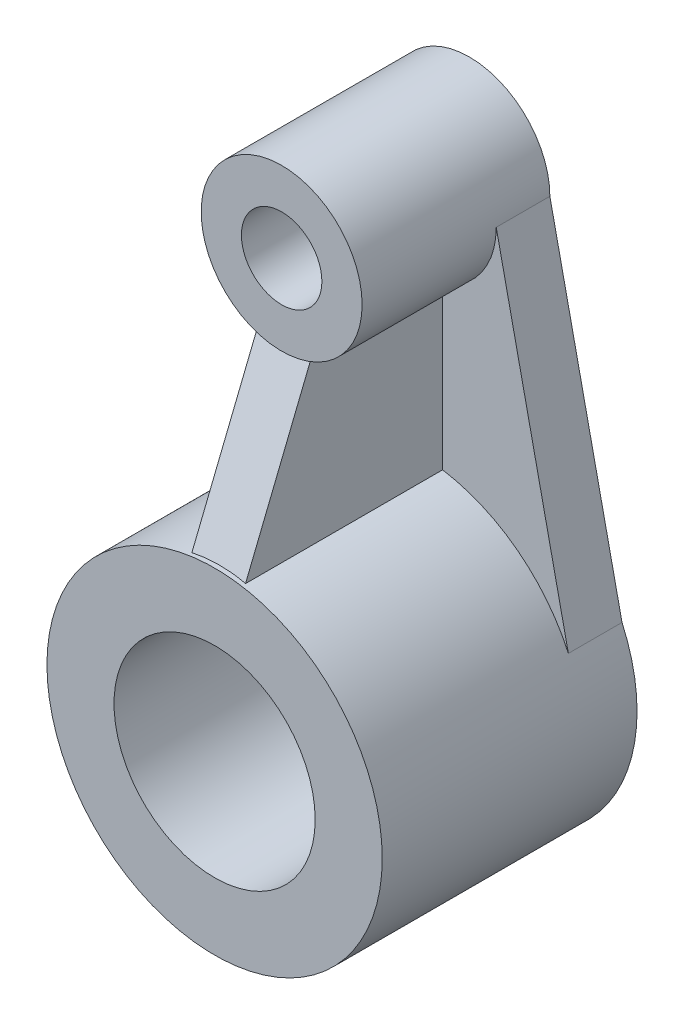
from build123d import *
from build123d.topology import SkipClean

# Parameters (mm, degrees)
SKETCH2_R           = 25
SKETCH2_R_2         = 15
BOSS_EXTRUDE1_DEPTH = 38
BOSS_EXTRUDE3_START = -8
BOSS_EXTRUDE3_DEPTH = 8
SKETCH4_R           = 12
SKETCH4_R_2         = 6
BOSS_EXTRUDE4_DEPTH = 20
BOSS_EXTRUDE5_START = 8
BOSS_EXTRUDE5_DEPTH = 8
CUT_EXTRUDE1_START  = -71
CUT_EXTRUDE1_DEPTH  = 71
BOSS_EXTRUDE8_DEPTH = 4


with BuildPart() as part:
    # Sketch2 → Boss-Extrude1 (new body)
    with BuildSketch(Plane.XY):
        with Locations((0, 6.726092211)):
            Circle(SKETCH2_R)
        with Locations((0, 6.726092211)):
            Circle(SKETCH2_R_2, mode=Mode.SUBTRACT)
    extrude(amount=-BOSS_EXTRUDE1_DEPTH)

    # Sketch5 → Boss-Extrude3 (add)
    with BuildSketch(Plane(origin=(0, 0, -38), x_dir=(-1, 0, 0), z_dir=(0, 0, -1)).offset(BOSS_EXTRUDE3_START)):
        with BuildLine():
            Line((-12, 66.726092211), (-22.758026002, 17.073664512))
            ThreePointArc((-22.758026002, 17.073664512), (0, 31.726092211), (22.758026002, 17.073664512))
            Line((22.758026002, 17.073664512), (12, 66.726092211))
            Line((12, 66.726092211), (-12, 66.726092211))
        make_face()
    extrude(amount=BOSS_EXTRUDE3_DEPTH)

    # Sketch4 → Boss-Extrude4 (add)
    with BuildSketch(Plane.XY.offset(-30)):
        with Locations((0, 66.726092211)):
            Circle(SKETCH4_R)
        with Locations((0, 66.726092211)):
            Circle(SKETCH4_R_2, mode=Mode.SUBTRACT)
    extrude(amount=BOSS_EXTRUDE4_DEPTH)

    # Sketch6 → Boss-Extrude5 (add)
    with BuildSketch(Plane(origin=(0, 0, -30), x_dir=(-1, 0, 0), z_dir=(0, 0, -1)).offset(BOSS_EXTRUDE5_START)):
        with BuildLine():
            Line((6, 66.726092211), (12, 66.726092211))
            ThreePointArc((12, 66.726092211), (0, 78.726092211), (-12, 66.726092211))
            Line((-12, 66.726092211), (-6, 66.726092211))
            ThreePointArc((-6, 66.726092211), (0, 72.726092211), (6, 66.726092211))
        make_face()
    extrude(amount=-BOSS_EXTRUDE5_DEPTH)

    # Sketch8 → Cut-Extrude1 (cut)
    with SkipClean():  # the faces are left unmerged after this step: merging them gives an invalid solid
        with BuildSketch(Plane.XY.offset(-30).offset(CUT_EXTRUDE1_START)):
            with BuildLine():
                Line((-6, 66.726092211), (6, 66.726092211))
                ThreePointArc((6, 66.726092211), (0, 60.726092211), (-6, 66.726092211))
            make_face()
        extrude(amount=CUT_EXTRUDE1_DEPTH, mode=Mode.SUBTRACT)

    # Sketch9 → Boss-Extrude8 (add, symmetric)
    with SkipClean():  # the faces are left unmerged after this step: merging them gives an invalid solid
        with BuildSketch(Plane(origin=(0, 0, 0), x_dir=(0, 0, -1), z_dir=(1, 0, 0))):
            Polygon((10.883614589, 56.807254431), (30, 56.807254431), (31.174578116, 56.807254431), (31.174578116, 29.887909486), (0, 29.887909486), align=None)
        extrude(amount=BOSS_EXTRUDE8_DEPTH, both=True)


solid = part.part
